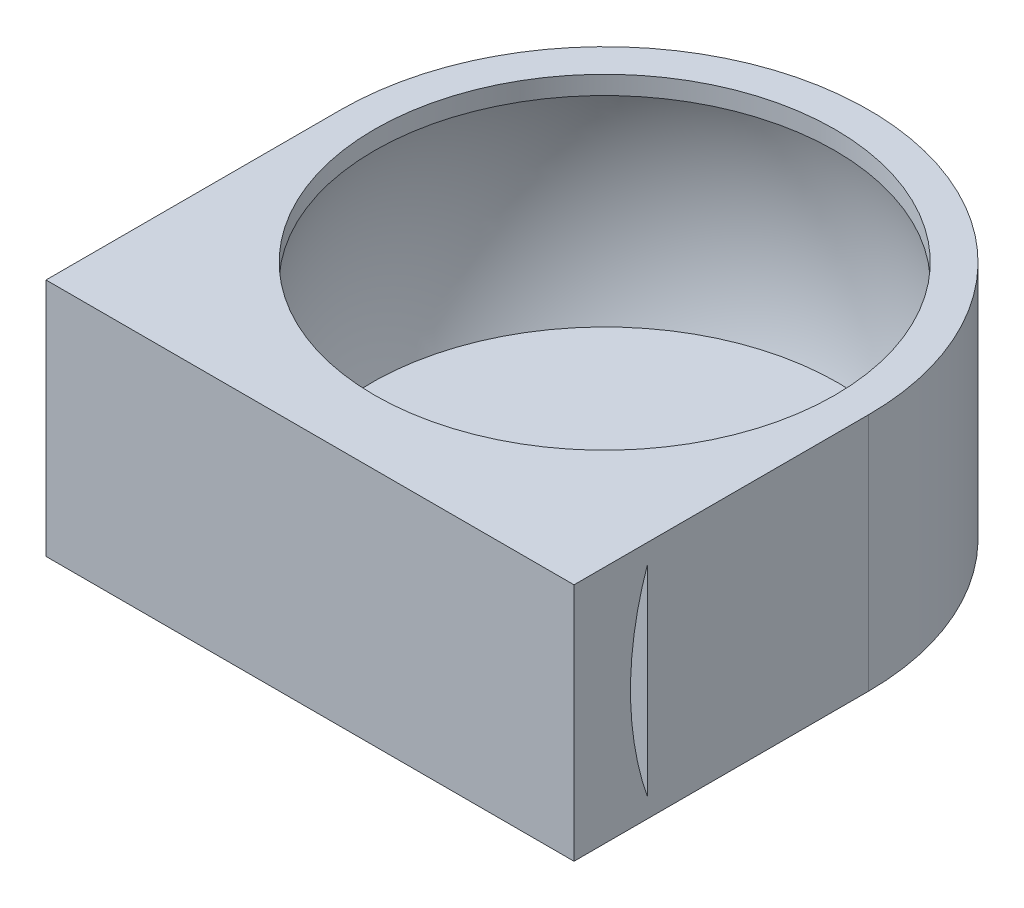
from build123d import *

# Parameters (mm, degrees)
SKETCH2_R               = 37.5
CUT_EXTRUDE1_DEPTH      = 3
BOSS_EXTRUDE1_DEPTH     = 39
CUT_EXTRUDE2_DEPTH      = 105.691212621
CUT_EXTRUDE2_DEPTH_BACK = 40


with BuildPart() as part:
    # Sketch1 → Revolve1 (revolve)
    with BuildSketch(Plane.XY, mode=Mode.PRIVATE) as revolve1_sk:
        with BuildLine():
            Line((38, -0.5), (0, -0.5))
            Line((0, -0.5), (0, -3.5))
            Line((0, -3.5), (43, -3.5))
            Line((43, -3.5), (43, 35.5))
            Line((43, 35.5), (0, 35.5))
            Line((0, 35.5), (0, 32.5))
            Line((0, 32.5), (38, 32.5))
            ThreePointArc((38, 32.5), (40.800953399, 16), (38, -0.5))
        make_face()
    revolve(revolve1_sk.sketch.rotate(Axis((0, -0.5, 0), (0, 1, 0)), 90), axis=Axis((0, -0.5, 0), (0, 1, 0)))

    # Sketch2 → Cut-Extrude1 (cut)
    with BuildSketch(Plane(origin=(0, 35.5, 0), x_dir=(1, 0, 0), z_dir=(0, 1, 0))):
        with Locations(Location((0, 0, 0), (0, 0, 270))):
            Circle(SKETCH2_R)
    extrude(amount=-CUT_EXTRUDE1_DEPTH, mode=Mode.SUBTRACT)

    # Sketch3 → Boss-Extrude1 (add)
    with BuildSketch(Plane(origin=(0, 35.5, 0), x_dir=(1, 0, 0), z_dir=(0, 1, 0))):
        with BuildLine():
            ThreePointArc((0, -43), (-30.405591591, -30.405591591), (-43, 0))
            Line((-43, 0), (-43, -43))
            Line((-43, -43), (0, -43))
        make_face()
        with BuildLine():
            Line((43, -43), (43, 0))
            ThreePointArc((43, 0), (30.405591591, -30.405591591), (0, -43))
            Line((0, -43), (43, -43))
        make_face()
        Polygon((43, -43), (43, -48), (-43, -48), (-43, -43), (0, -43), align=None)
    extrude(amount=-BOSS_EXTRUDE1_DEPTH)

    # Sketch4 → Cut-Extrude2 (cut, two sides: drawn at the far end of the back side and taken through both)
    with BuildSketch(Plane(origin=(43, 0, 0), x_dir=(0, 0, -1), z_dir=(1, 0, 0)).offset(-CUT_EXTRUDE2_DEPTH_BACK)):
        with BuildLine():
            Line((-36, 32.5), (-36, -0.5))
            ThreePointArc((-36, -0.5), (-38.800953399, 16), (-36, 32.5))
        make_face()
    extrude(amount=CUT_EXTRUDE2_DEPTH + CUT_EXTRUDE2_DEPTH_BACK, mode=Mode.SUBTRACT)


solid = part.part
